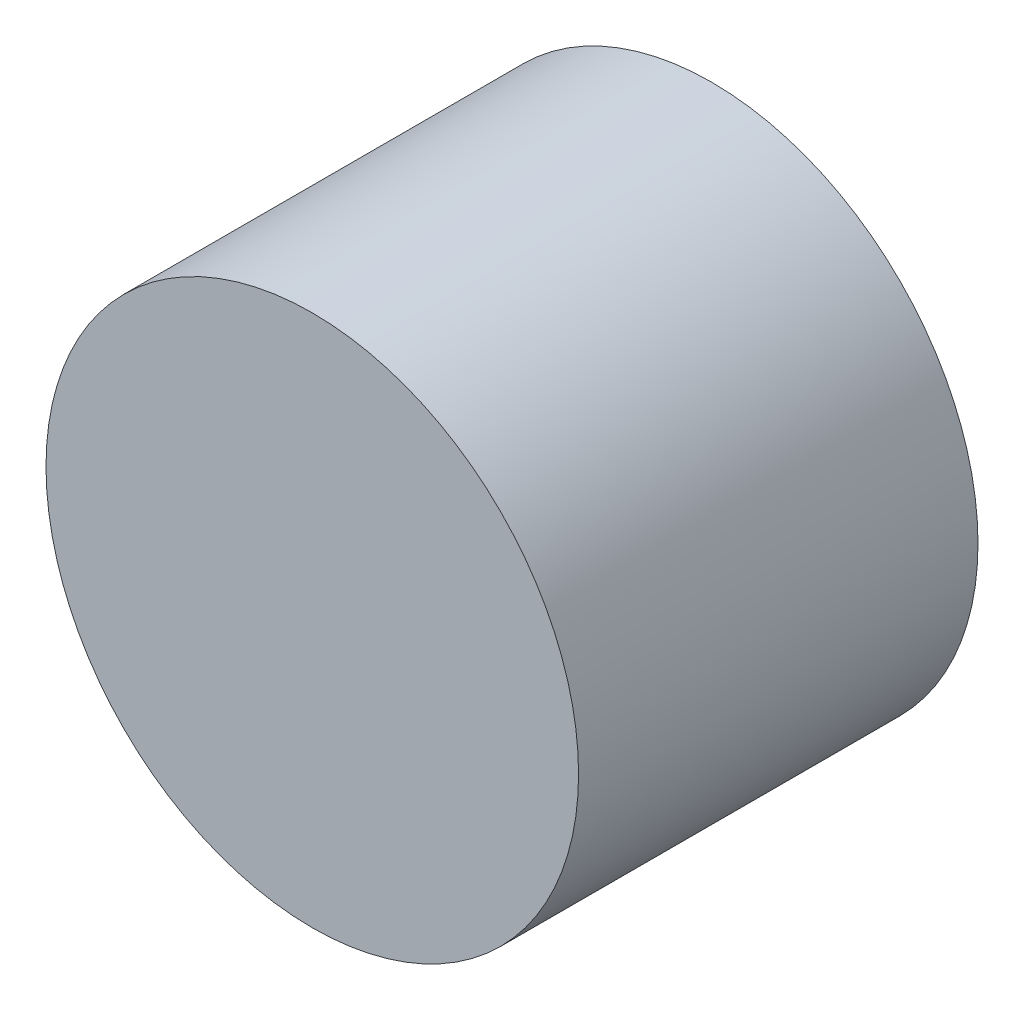
from build123d import *

# Parameters (mm, degrees)
ESQUISSE1_R          = 4
BASE_EXTRUSION_DEPTH = 6


with BuildPart() as part:
    # Esquisse1 → Base-Extrusion (new body)
    with BuildSketch(Plane.XY):
        Circle(ESQUISSE1_R)
    extrude(amount=BASE_EXTRUSION_DEPTH)


solid = part.part
